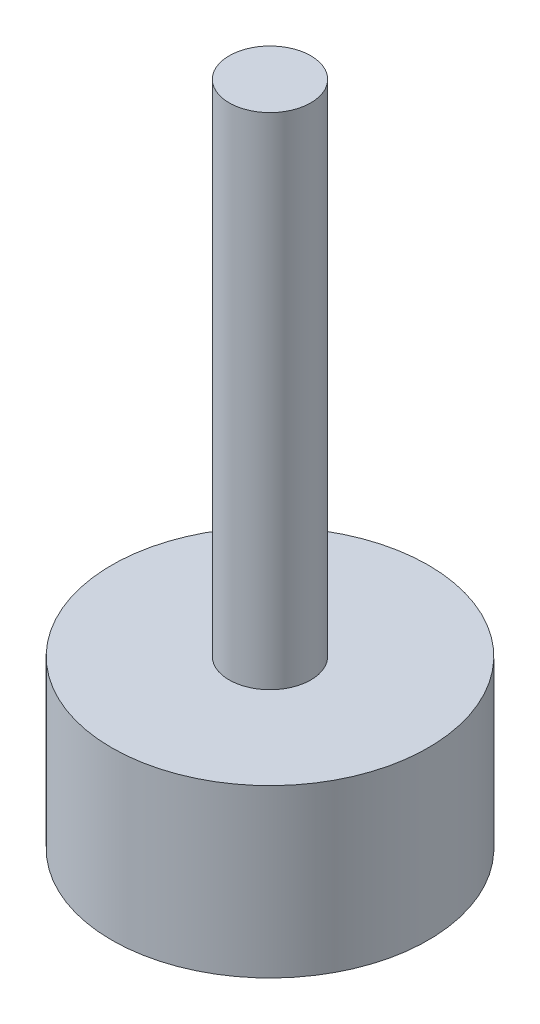
from build123d import *

# Parameters (mm, degrees)
SKETCH1_R           = 12.065
BOSS_EXTRUDE1_DEPTH = 12.7
SKETCH2_R           = 3.1115
BOSS_EXTRUDE2_DEPTH = 38.1


with BuildPart() as part:
    # Sketch1 → Boss-Extrude1 (new body)
    with BuildSketch(Plane(origin=(0, 0, 0), x_dir=(1, 0, 0), z_dir=(0, 1, 0))):
        with Locations(Location((0, 0, 0), (0, 0, 270))):
            Circle(SKETCH1_R)
    extrude(amount=BOSS_EXTRUDE1_DEPTH)

    # Sketch2 → Boss-Extrude2 (add)
    with BuildSketch(Plane(origin=(0, 12.7, 0), x_dir=(1, 0, 0), z_dir=(0, 1, 0))):
        with Locations(Location((0, 0, 0), (0, 0, 90))):
            Circle(SKETCH2_R)
    extrude(amount=BOSS_EXTRUDE2_DEPTH)


solid = part.part
